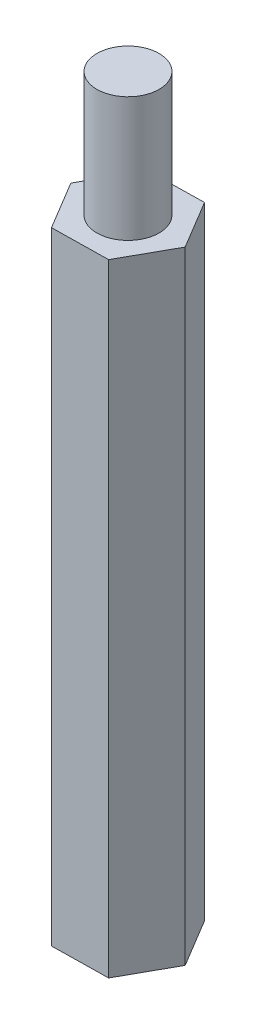
from build123d import *

# Parameters (mm, degrees)
SKETCH_1_R      = 1.5
EXTRUDE_1_DEPTH = 30
SKETCH_2_R      = 1.5
EXTRUDE_2_DEPTH = 6


with BuildPart() as part:
    # 草图1 → 凸台-拉伸1 (new body)
    with BuildSketch(Plane(origin=(0, 0, 0), x_dir=(1, 0, 0), z_dir=(0, 1, 0))):
        Polygon((1.394530192, -2.327792705), (2.713192713, 0.04380222), (1.318662521, 2.371594925), (-1.394530192, 2.327792705), (-2.713192713, -0.04380222), (-1.318662521, -2.371594925), align=None)
        with Locations(Location((0, 0, 0), (0, 0, 270))):
            Circle(SKETCH_1_R, mode=Mode.SUBTRACT)
    extrude(amount=EXTRUDE_1_DEPTH)


with BuildPart() as body_2:
    # 草图2 → 凸台-拉伸2 (new body)
    with BuildSketch(Plane(origin=(0, 30, 0), x_dir=(1, 0, 0), z_dir=(0, 1, 0))):
        with Locations(Location((0, 0, 0), (0, 0, 270))):
            Circle(SKETCH_2_R)
    extrude(amount=EXTRUDE_2_DEPTH)


solid = Compound([part.part, body_2.part])
